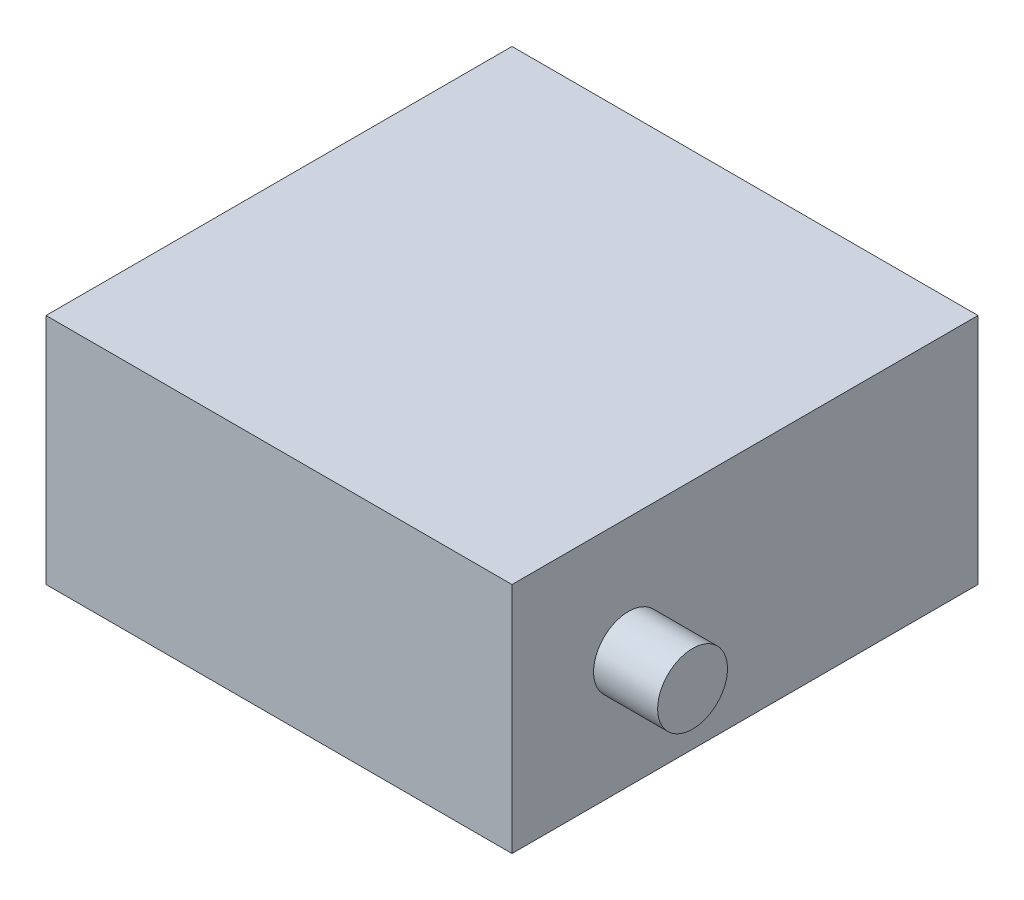
from build123d import *

# Parameters (mm, degrees)
CROQUIS1_W              = 40
CROQUIS1_H              = 20
SALIENTE_EXTRUIR1_DEPTH = 40
CROQUIS2_R              = 3
SALIENTE_EXTRUIR2_DEPTH = 5.5


with BuildPart() as part:
    # Croquis1 → Saliente-Extruir1 (new body)
    with BuildSketch(Plane.XY):
        Rectangle(CROQUIS1_W, CROQUIS1_H)
    extrude(amount=SALIENTE_EXTRUIR1_DEPTH)

    # Croquis2 → Saliente-Extruir2 (add)
    with BuildSketch(Plane.ZY.offset(20)):
        with Locations(Location((30, 0, 0), (0, 0, 180))):
            Circle(CROQUIS2_R)
    saliente_extruir2 = extrude(amount=SALIENTE_EXTRUIR2_DEPTH)

    # Simetría1: Saliente-Extruir2 across plane
    add(saliente_extruir2.mirror(Plane(origin=(0, 0, 0), x_dir=(0, 0, 1), z_dir=(1, 0, 0))))


solid = part.part
